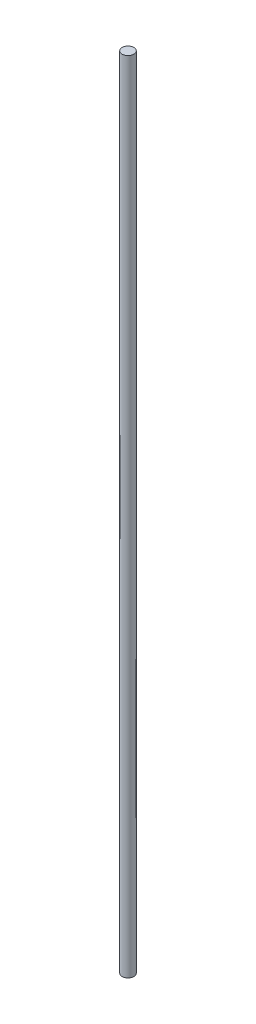
from build123d import *

# Parameters (mm, degrees)
SKETCH1_R           = 4
BOSS_EXTRUDE1_DEPTH = 272


with BuildPart() as part:
    # Sketch1 → Boss-Extrude1 (new, symmetric)
    with BuildSketch(Plane(origin=(0, 0, 0), x_dir=(1, 0, 0), z_dir=(0, 1, 0))):
        with Locations(Location((0, 0, 0), (0, 0, 270))):
            Circle(SKETCH1_R)
    extrude(amount=BOSS_EXTRUDE1_DEPTH, both=True)


solid = part.part
